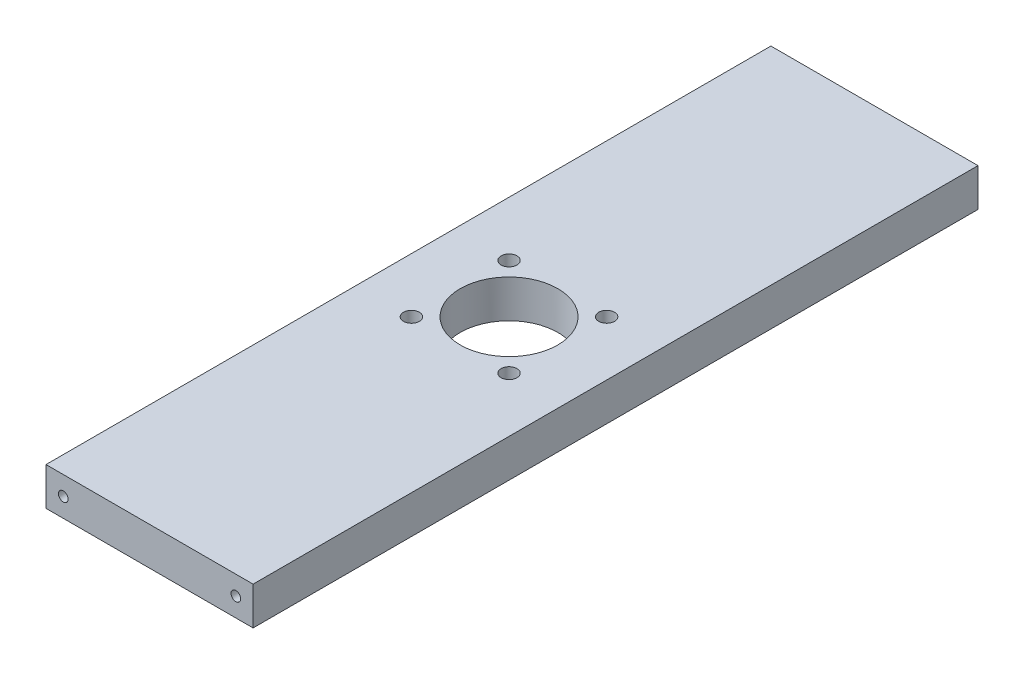
from build123d import *

# Parameters (mm, degrees)
IZIM1_W                     = 60
IZIM1_H                     = 11
Y_KSEKLIK_EKSTR_ZYON1_DEPTH = 210
KES_EKSTR_ZYON1_DEPTH       = 213.996779223
KES_EKSTR_ZYON1_DEPTH_BACK  = 213.996779223
IZIM2_R                     = 14.14
IZIM2_R_2                   = 2.3
IZIM3_R                     = 1.4
KES_EKSTR_ZYON2_DEPTH       = 21
KES_EKSTR_ZYON3_START       = -21
IZIM4_R                     = 1.4
KES_EKSTR_ZYON3_DEPTH       = 21


with BuildPart() as part:
    # Çizim1 → Yükseklik-Ekstrüzyon1 (new body)
    with BuildSketch(Plane.XY):
        with Locations((3.861895391, 4.551835536)):
            Rectangle(IZIM1_W, IZIM1_H)
    extrude(amount=Y_KSEKLIK_EKSTR_ZYON1_DEPTH)

    # Çizim2 → Kes-Ekstrüzyon1 (cut, two sides: drawn at the far end of the back side and taken through both)
    with BuildSketch(Plane(origin=(0, 10.051835536, 0), x_dir=(1, 0, 0), z_dir=(0, 1, 0)).offset(-KES_EKSTR_ZYON1_DEPTH_BACK)):
        with Locations(Location((3.861895391, -105.86, 0), (0, 0, 270))):
            Circle(IZIM2_R)
        with Locations(Location((-10.278104609, -91.72, 0), (0, 0, 270))):
            Circle(IZIM2_R_2)
        with Locations(Location((18.001895391, -91.72, 0), (0, 0, 270))):
            Circle(IZIM2_R_2)
        with Locations(Location((18.001895391, -120, 0), (0, 0, 270))):
            Circle(IZIM2_R_2)
        with Locations(Location((-10.278104609, -120, 0), (0, 0, 270))):
            Circle(IZIM2_R_2)
    extrude(amount=KES_EKSTR_ZYON1_DEPTH + KES_EKSTR_ZYON1_DEPTH_BACK, mode=Mode.SUBTRACT)

    # Çizim3 → Kes-Ekstrüzyon2 (cut)
    with BuildSketch(Plane(origin=(0, 0, 0), x_dir=(-1, 0, 0), z_dir=(0, 0, -1))):
        with Locations((21.138104609, 4.551835536)):
            Circle(IZIM3_R)
        with Locations((-28.861895391, 4.551835536)):
            Circle(IZIM3_R)
    extrude(amount=-KES_EKSTR_ZYON2_DEPTH, mode=Mode.SUBTRACT)

    # Çizim4 → Kes-Ekstrüzyon3 (cut)
    with BuildSketch(Plane.XY.offset(210).offset(KES_EKSTR_ZYON3_START)):
        with Locations(Location((-21.138104609, 4.551835536, 0), (0, 0, 180))):
            Circle(IZIM4_R)
        with Locations(Location((28.861895391, 4.551835536, 0), (0, 0, 180))):
            Circle(IZIM4_R)
    extrude(amount=KES_EKSTR_ZYON3_DEPTH, mode=Mode.SUBTRACT)


solid = part.part
